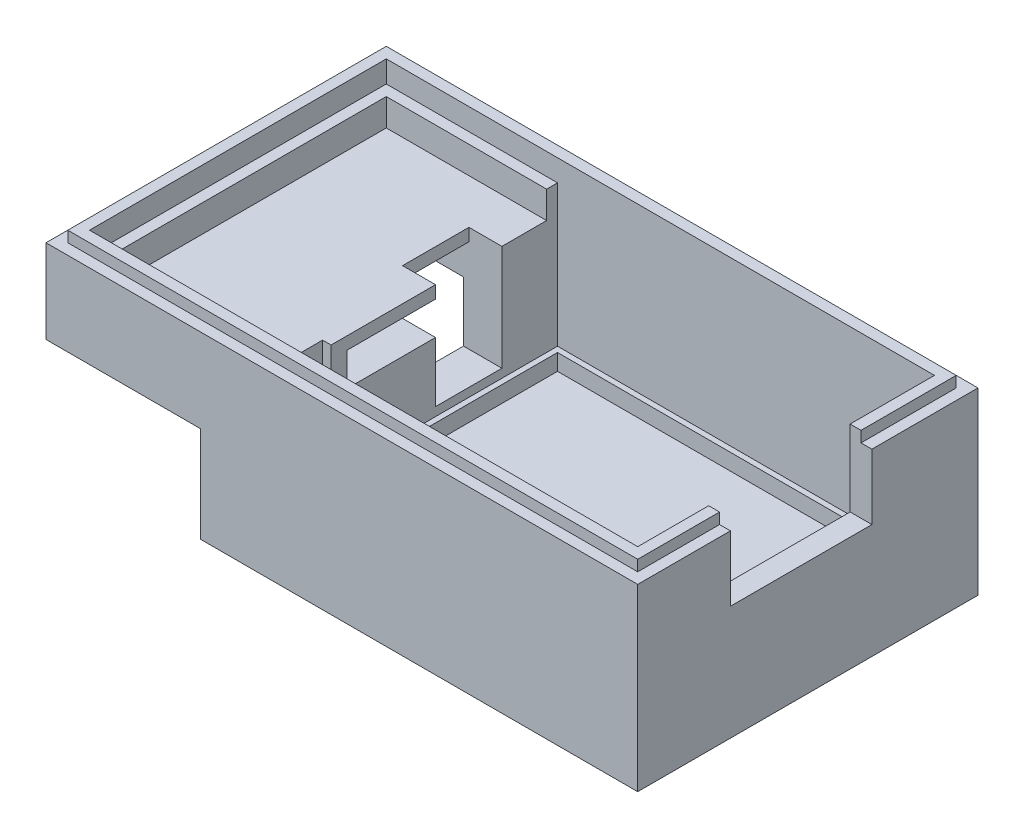
from build123d import *

# Parameters (mm, degrees)
EXTRUDE_1_DEPTH      = 28
EXTRUDE_1_DEPTH_BACK = 5
SKETCH_6_W           = 108.75
SKETCH_6_H           = 62.54
SKETCH_8_W           = 100.75
SKETCH_8_H           = 54.54
CUT_EXTRUDE_1_DEPTH  = 7
CUT_EXTRUDE_2_DEPTH  = 19.4
SKETCH_10_W          = 69.18
SKETCH_10_H          = 54.54
CUT_EXTRUDE_3_DEPTH  = 1.6
SKETCH_11_W          = 67.18
SKETCH_11_H          = 52.54
CUT_EXTRUDE_4_DEPTH  = 3
SKETCH_12_W          = 12.2
SKETCH_12_H          = 11
CUT_EXTRUDE_5_DEPTH  = 103.440564231
CUT_EXTRUDE_6_REACH  = 128.593
SKETCH_14_W          = 28.5
SKETCH_14_H          = 4.5
CUT_EXTRUDE_7_REACH  = 101.961
SKETCH_15_W          = 28.41
SKETCH_15_H          = 17.6
EXTRUDE_2_DEPTH      = 5
CUT_EXTRUDE_14_REACH = 128.593
SKETCH_23_W          = 28.5
SKETCH_23_H          = 1.6
SKETCH_25_W          = 104.75
SKETCH_25_H          = 58.54
SKETCH_25_W_2        = 100.75
SKETCH_25_H_2        = 54.54
EXTRUDE_3_DEPTH      = 2
SKETCH_26_W          = 26
SKETCH_26_H          = 14
CUT_EXTRUDE_15_DEPTH = 4


with BuildPart() as part:
    # ｽｹｯﾁ6 → ﾎﾞｽ - 押し出し1 (new, two sides: drawn at the far end of the back side and taken through both)
    with BuildSketch(Plane(origin=(0, 0, 0), x_dir=(1, 0, 0), z_dir=(0, 1, 0)).offset(-EXTRUDE_1_DEPTH_BACK)):
        with Locations((18.405, 27.17)):
            Rectangle(SKETCH_6_W, SKETCH_6_H)
    extrude(amount=EXTRUDE_1_DEPTH + EXTRUDE_1_DEPTH_BACK)

    # ｽｹｯﾁ8 → ｶｯﾄ - 押し出し1 (cut)
    with BuildSketch(Plane(origin=(0, 28, 0), x_dir=(1, 0, 0), z_dir=(0, 1, 0))):
        with Locations((18.405, 27.17)):
            Rectangle(SKETCH_8_W, SKETCH_8_H)
    extrude(amount=-CUT_EXTRUDE_1_DEPTH, mode=Mode.SUBTRACT)

    # ｽｹｯﾁ9 → ｶｯﾄ - 押し出し2 (cut)
    with BuildSketch(Plane(origin=(0, 21, 0), x_dir=(1, 0, 0), z_dir=(0, 1, 0))):
        Polygon((-0.5, 54.44), (-0.5, 44.22), (-6.56, 44.22), (-6.56, 32.02), (-0.5, 32.02), (-0.5, 12.82), (-2.06, 12.82), (-2.06, 3.62), (-0.5, 3.62), (-0.5, -0.1), (68.78, -0.1), (68.78, 54.44), align=None)
    extrude(amount=-CUT_EXTRUDE_2_DEPTH, mode=Mode.SUBTRACT)

    # ｽｹｯﾁ10 → ｶｯﾄ - 押し出し3 (cut)
    with BuildSketch(Plane(origin=(0, 1.6, 0), x_dir=(1, 0, 0), z_dir=(0, 1, 0))):
        with Locations((34.09, 27.17)):
            Rectangle(SKETCH_10_W, SKETCH_10_H)
    extrude(amount=-CUT_EXTRUDE_3_DEPTH, mode=Mode.SUBTRACT)

    # ｽｹｯﾁ11 → ｶｯﾄ - 押し出し4 (cut)
    with BuildSketch(Plane(origin=(0, 0, 0), x_dir=(1, 0, 0), z_dir=(0, 1, 0))):
        with Locations((34.09, 27.17)):
            Rectangle(SKETCH_11_W, SKETCH_11_H)
    extrude(amount=-CUT_EXTRUDE_4_DEPTH, mode=Mode.SUBTRACT)

    # ｽｹｯﾁ12 → ｶｯﾄ - 押し出し5 (cut, through all)
    with BuildSketch(Plane(origin=(-6.56, 0, 0), x_dir=(0, 0, -1), z_dir=(1, 0, 0))):
        with Locations((38.12, 7.1)):
            Rectangle(SKETCH_12_W, SKETCH_12_H)
    extrude(amount=-CUT_EXTRUDE_5_DEPTH, mode=Mode.SUBTRACT)

    # ｽｹｯﾁ14 → ｶｯﾄ - 押し出し6 (cut, up to next)
    with BuildSketch(Plane.ZY.offset(35.97), mode=Mode.PRIVATE) as cut_extrude_6_sk1:
        with Locations((-29.97, 16.45)):
            Rectangle(SKETCH_14_W, SKETCH_14_H)
    cut_extrude_6_tool1 = extrude(cut_extrude_6_sk1.sketch, amount=-CUT_EXTRUDE_6_REACH, mode=Mode.PRIVATE) & part.part
    add(cut_extrude_6_tool1.solids().sort_by_distance((-35.97, 16.45, -29.97))[0], mode=Mode.SUBTRACT)

    # ｶｯﾄ - 押し出し7: up to this face of the body (flat: up to its plane)
    cut_extrude_7_end = Plane(part.part.faces().sort_by_distance((18.405, 11.5, -58.44))[0])
    # ｽｹｯﾁ15 → ｶｯﾄ - 押し出し7 (cut, up to the picked face)
    with BuildSketch(Plane.XY.offset(4.1), mode=Mode.PRIVATE) as cut_extrude_7_sk1:
        with Locations((-21.765, 3.8)):
            Rectangle(SKETCH_15_W, SKETCH_15_H)
    cut_extrude_7_tool1 = split(extrude(cut_extrude_7_sk1.sketch, amount=-CUT_EXTRUDE_7_REACH, mode=Mode.PRIVATE), bisect_by=cut_extrude_7_end, keep=Keep.BOTH, mode=Mode.PRIVATE)
    add(cut_extrude_7_tool1.solids().sort_by(Axis((-21.765, 3.8, 4.1), (0, 0, -1)))[0], mode=Mode.SUBTRACT)

    # ｽｹｯﾁ16 → ﾎﾞｽ - 押し出し2 (add)
    with BuildSketch(Plane(origin=(0, 21, 0), x_dir=(1, 0, 0), z_dir=(0, 1, 0))):
        Polygon((-0.5, 54.44), (-31.97, 54.44), (-31.97, -0.1), (0, -0.1), (0, 1.9), (-29.97, 1.9), (-29.97, 52.44), (-0.5, 52.44), align=None)
    extrude(amount=EXTRUDE_2_DEPTH)

    # ｽｹｯﾁ23 → ｶｯﾄ - 押し出し14 (cut, up to next)
    with BuildSketch(Plane.ZY.offset(35.97), mode=Mode.PRIVATE) as cut_extrude_14_sk1:
        with Locations((-29.97, 13.4)):
            Rectangle(SKETCH_23_W, SKETCH_23_H)
    cut_extrude_14_tool1 = extrude(cut_extrude_14_sk1.sketch, amount=-CUT_EXTRUDE_14_REACH, mode=Mode.PRIVATE) & part.part
    add(cut_extrude_14_tool1.solids().sort_by_distance((-35.97, 13.4, -29.97))[0], mode=Mode.SUBTRACT)

    # ｽｹｯﾁ25 → ﾎﾞｽ - 押し出し3 (add)
    with BuildSketch(Plane(origin=(0, 28, 0), x_dir=(1, 0, 0), z_dir=(0, 1, 0))):
        with Locations((18.405, 27.17)):
            Rectangle(SKETCH_25_W, SKETCH_25_H)
        with Locations((18.405, 27.17)):
            Rectangle(SKETCH_25_W_2, SKETCH_25_H_2, mode=Mode.SUBTRACT)
    extrude(amount=EXTRUDE_3_DEPTH)

    # ｽｹｯﾁ26 → ｶｯﾄ - 押し出し15 (cut)
    with BuildSketch(Plane.ZY.offset(-68.78)):
        with Locations((-25.94, 23)):
            Rectangle(SKETCH_26_W, SKETCH_26_H)
    extrude(amount=-CUT_EXTRUDE_15_DEPTH, mode=Mode.SUBTRACT)


solid = part.part
